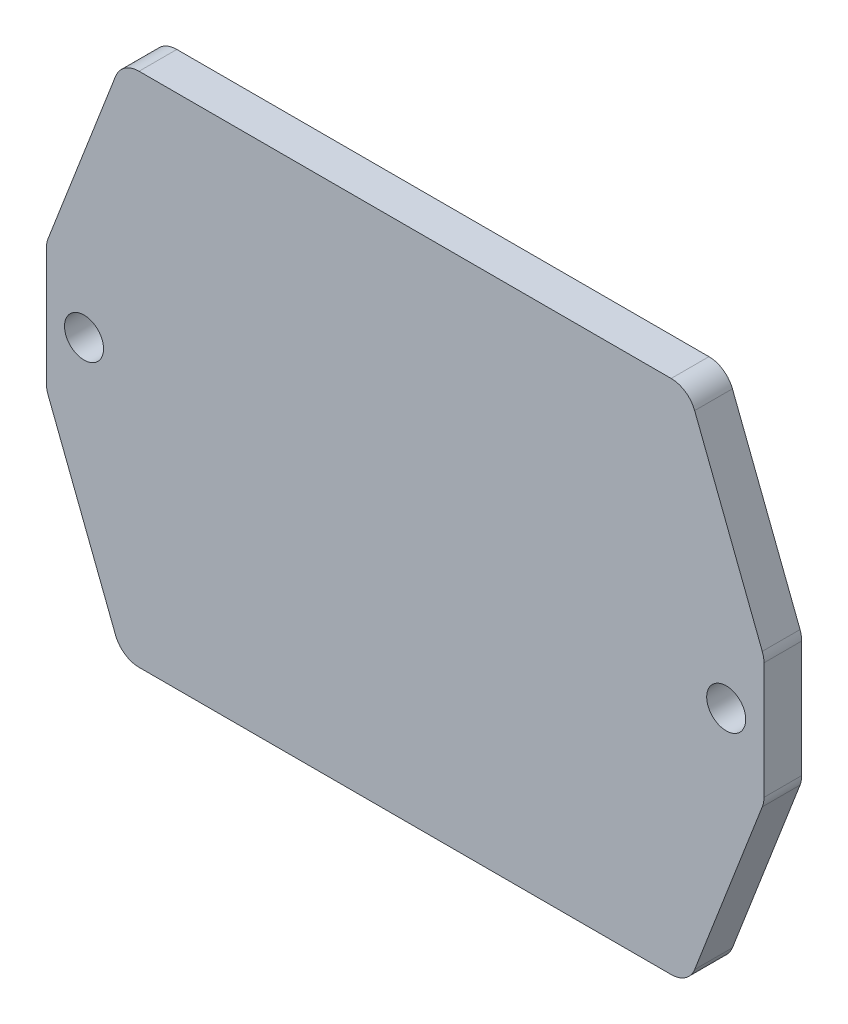
from build123d import *

# Parameters (mm, degrees)
SKETCH_1_W          = 45
SKETCH_1_H          = 41
EXTRUDE_1_DEPTH     = 3
SKETCH_2_W          = 12
SKETCH_2_H          = 10
EXTRUDE_2_DEPTH     = 3
EXTRUDE_3_DEPTH     = 3
SKETCH_4_R          = 1.55
CUT_EXTRUDE_1_DEPTH = 3
FILLET_1_R          = 2


with BuildPart() as part:
    # 草图1 → 凸台-拉伸1 (new body)
    with BuildSketch(Plane.XY):
        Rectangle(SKETCH_1_W, SKETCH_1_H)
    extrude(amount=EXTRUDE_1_DEPTH)

    # 草图2 → 凸台-拉伸2 (add)
    with BuildSketch(Plane.XY.offset(3)):
        with Locations((22.5, 0)):
            Rectangle(SKETCH_2_W, SKETCH_2_H)
        with Locations((-22.5, 0)):
            Rectangle(SKETCH_2_W, SKETCH_2_H)
    extrude(amount=-EXTRUDE_2_DEPTH)

    # 草图3 → 凸台-拉伸3 (add)
    with BuildSketch(Plane.XY.offset(3)):
        Polygon((-22.5, 20.5), (-28.5, 5), (-22.5, 5), align=None)
        Polygon((22.5, 5), (22.5, 20.5), (28.5, 5), align=None)
        Polygon((-28.5, -5), (-22.5, -5), (-22.5, -20.5), align=None)
        Polygon((22.5, -20.5), (28.5, -5), (22.5, -5), align=None)
    extrude(amount=-EXTRUDE_3_DEPTH)

    # 草图4 → 切除-拉伸1 (cut)
    with BuildSketch(Plane.XY.offset(3)):
        with Locations((25.5, 0)):
            Circle(SKETCH_4_R)
        with Locations(Location((-25.5, 0, 0), (0, 0, 180))):
            Circle(SKETCH_4_R)
    extrude(amount=-CUT_EXTRUDE_1_DEPTH, mode=Mode.SUBTRACT)

    # 圆角1
    fillet_1_edges = [part.edges().sort_by_distance(p)[0] for p in [
        (28.5, -5, 1.5),
        (28.5, 5, 1.5),
        (-28.5, 5, 1.5),
        (-28.5, -5, 1.5),
        (22.5, -20.5, 1.5),
        (-22.5, -20.5, 1.5),
        (-22.5, 20.5, 1.5),
        (22.5, 20.5, 1.5),
    ]]
    fillet(fillet_1_edges, radius=FILLET_1_R)


solid = part.part
